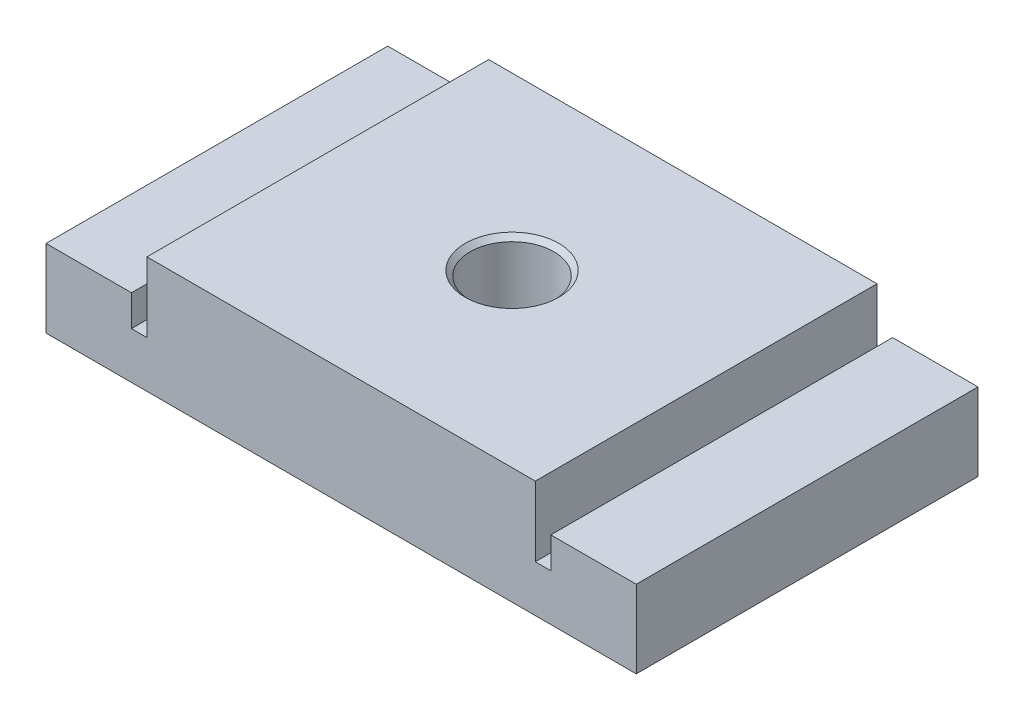
from build123d import *

# Parameters (mm, degrees)
BOSS_EXTRUDE1_DEPTH               = 22
M12X1_25_TAPPED_HOLE1_D           = 10.8
M12X1_25_TAPPED_HOLE1_CSINK_D     = 12.05
M12X1_25_TAPPED_HOLE1_CSINK_ANGLE = 90


with BuildPart() as part:
    # Sketch1 → Boss-Extrude1 (new, symmetric)
    with BuildSketch(Plane.XY):
        Polygon((-38, 0), (-38, 10), (-27, 10), (-27, 6), (-25, 6), (-25, 15), (25, 15), (25, 6), (27, 6), (27, 10), (38, 10), (38, 0), align=None)
    extrude(amount=BOSS_EXTRUDE1_DEPTH, both=True)

    # M12x1.25 Tapped Hole1 (through all)
    with Locations(Plane(origin=(0, 15, 0), x_dir=(1, 0, 0), z_dir=(0, 1, 0))):
        with Locations((0, 0)):
            CounterSinkHole(M12X1_25_TAPPED_HOLE1_D / 2, M12X1_25_TAPPED_HOLE1_CSINK_D / 2, counter_sink_angle=M12X1_25_TAPPED_HOLE1_CSINK_ANGLE)


solid = part.part
